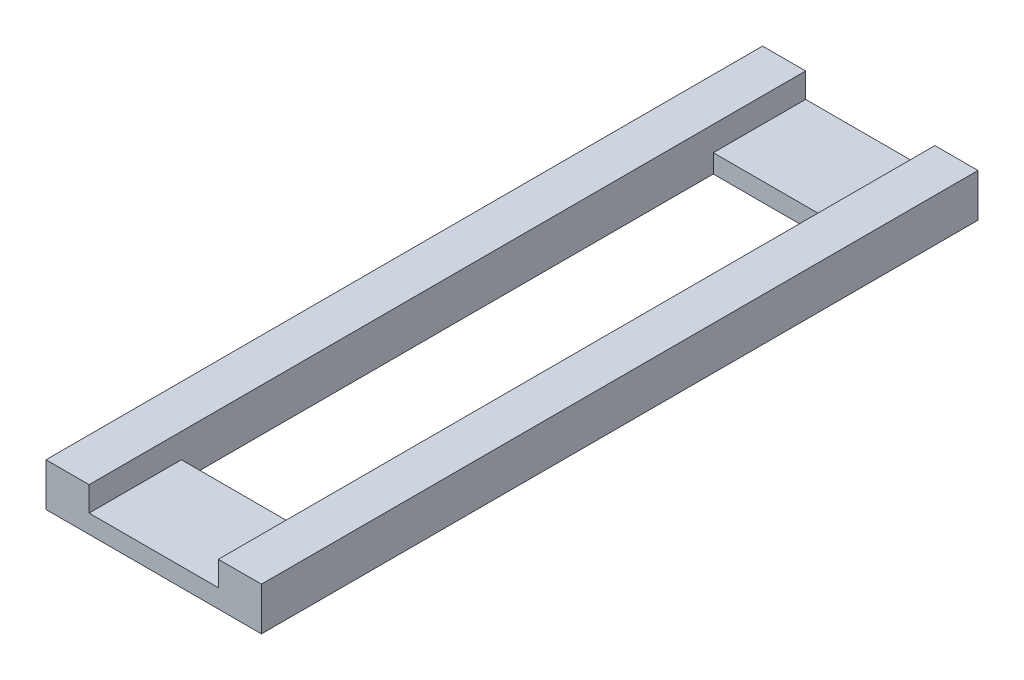
from build123d import *

# Parameters (mm, degrees)
CROQUIS1_W              = 175
CROQUIS1_H              = 582
SALIENTE_EXTRUIR1_DEPTH = 35
CROQUIS2_W              = 105
CROQUIS2_H              = 582
CORTAR_EXTRUIR1_DEPTH   = 20
CROQUIS3_W              = 105
CROQUIS3_H              = 432
CORTAR_EXTRUIR2_DEPTH   = 305.527913335


with BuildPart() as part:
    # Croquis1 → Saliente-Extruir1 (new body)
    with BuildSketch(Plane(origin=(0, 0, 0), x_dir=(1, 0, 0), z_dir=(0, 1, 0))):
        Rectangle(CROQUIS1_W, CROQUIS1_H)
    extrude(amount=SALIENTE_EXTRUIR1_DEPTH)

    # Croquis2 → Cortar-Extruir1 (cut)
    with BuildSketch(Plane(origin=(0, 35, 0), x_dir=(1, 0, 0), z_dir=(0, 1, 0))):
        Rectangle(CROQUIS2_W, CROQUIS2_H)
    extrude(amount=-CORTAR_EXTRUIR1_DEPTH, mode=Mode.SUBTRACT)

    # Croquis3 → Cortar-Extruir2 (cut, through all)
    with BuildSketch(Plane(origin=(0, 15, 0), x_dir=(1, 0, 0), z_dir=(0, 1, 0))):
        Rectangle(CROQUIS3_W, CROQUIS3_H)
    extrude(amount=-CORTAR_EXTRUIR2_DEPTH, mode=Mode.SUBTRACT)


solid = part.part
